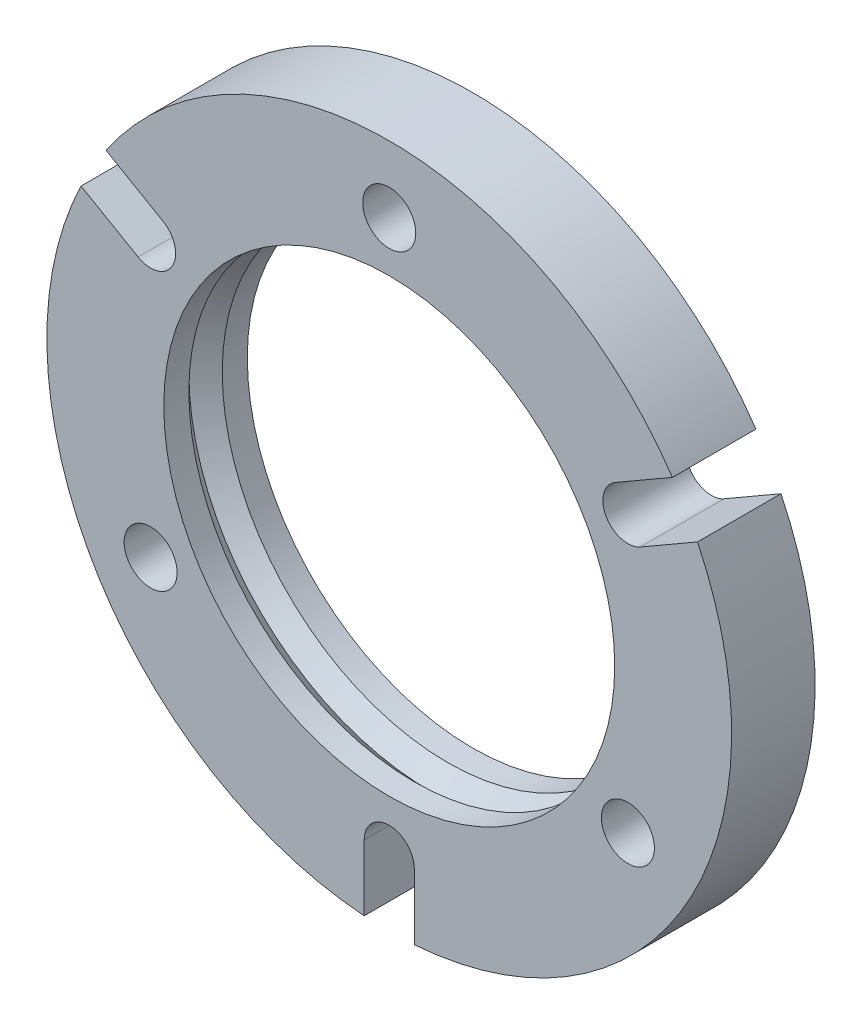
from build123d import *

# Parameters (mm, degrees)
SKETCH1_R          = 20.5
SKETCH1_R_2        = 13.5
SKETCH1_R_3        = 1.5875
EXTRUDE1_DEPTH     = 5
CUT_EXTRUDE1_DEPTH = 30.419381367
CIRPATTERN1_COUNT  = 3


with BuildPart() as part:
    # Sketch1 → Extrude1 (new body)
    with BuildSketch(Plane.XY):
        Circle(SKETCH1_R)
        Circle(SKETCH1_R_2, mode=Mode.SUBTRACT)
        with Locations((0, 16.5)):
            Circle(SKETCH1_R_3, mode=Mode.SUBTRACT)
        with Locations((14.289419162, -8.25)):
            Circle(SKETCH1_R_3, mode=Mode.SUBTRACT)
        with Locations((-14.289419162, -8.25)):
            Circle(SKETCH1_R_3, mode=Mode.SUBTRACT)
    extrude(amount=EXTRUDE1_DEPTH)

    # Sketch2 → Cut-Extrude1 (cut, through all)
    with BuildSketch(Plane.XY.offset(5)):
        with BuildLine():
            ThreePointArc((1.5, -16.5), (0, -15), (-1.5, -16.5))
            Line((-1.5, -16.5), (-1.5, -20.4450483))
            ThreePointArc((-1.5, -20.4450483), (0, -20.5), (1.5, -20.4450483))
            Line((1.5, -20.4450483), (1.5, -16.5))
        make_face()
    cut_extrude1 = extrude(amount=-CUT_EXTRUDE1_DEPTH, mode=Mode.SUBTRACT)

    # Sketch4 → Cut-Revolve3 (revolve, cut)
    with BuildSketch(Plane(origin=(0, 0, 0), x_dir=(1, 0, 0), z_dir=(0, 1, 0))):
        Polygon((-13.5, -1.5), (-14.5, -2.5), (-13.5, -3.5), align=None)
    revolve(axis=Axis((0, 0, 0), (0, 0, 1)), mode=Mode.SUBTRACT)

    # CirPattern1: Cut-Extrude1 ×3 about axis
    cirpattern1_axis = Axis((0, 0, 5), (0, 0, -1))
    for i in range(1, CIRPATTERN1_COUNT):
        add(cut_extrude1.rotate(cirpattern1_axis, i * 360 / CIRPATTERN1_COUNT), mode=Mode.SUBTRACT)


solid = part.part
